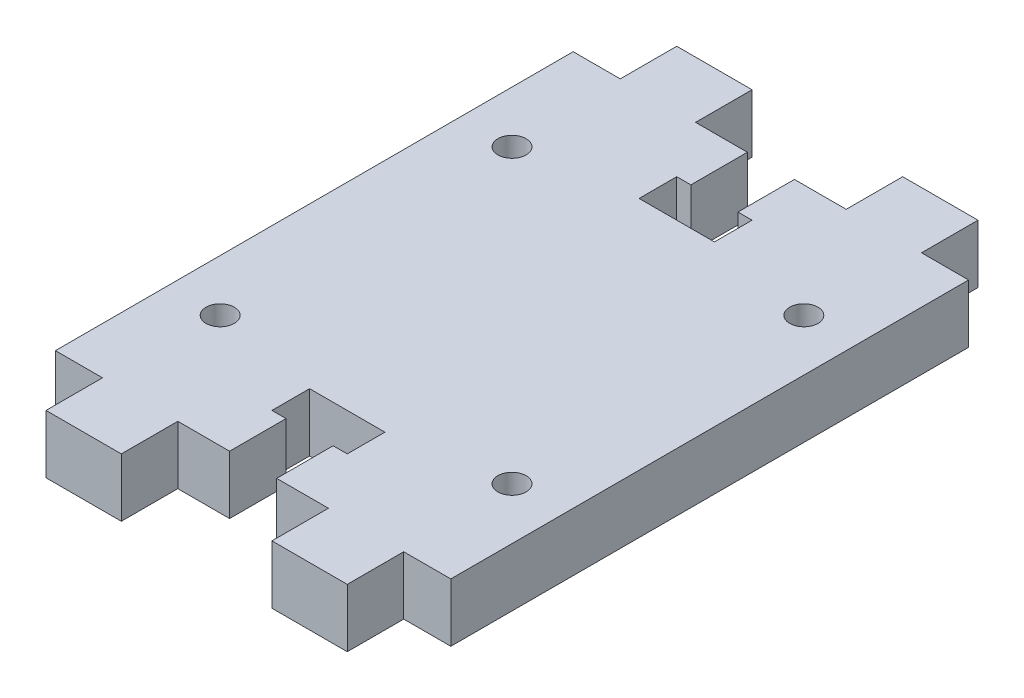
from build123d import *

# Parameters (mm, degrees)
BOSS_EXTRUDE1_DEPTH = 6.2
CUT_EXTRUDE1_REACH  = 42.021
SKETCH2_R           = 1.5


with BuildPart() as part:
    # Sketch1 → Boss-Extrude1 (new body)
    with BuildSketch(Plane(origin=(0, 0, 0), x_dir=(1, 0, 0), z_dir=(0, 1, 0))):
        Polygon((-21, 27.5), (-16, 27.5), (-16, 33.5), (-8, 33.5), (-8, 27.5), (-2.5, 27.5), (-2.5, 21.5), (-4, 21.5), (-4, 17.5), (4, 17.5), (4, 21.5), (2.5, 21.5), (2.5, 27.5), (8, 27.5), (8, 33.5), (16, 33.5), (16, 27.5), (21, 27.5), (21, -27.5), (16, -27.5), (16, -33.5), (8, -33.5), (8, -27.5), (2.5, -27.5), (2.5, -21.5), (4, -21.5), (4, -17.5), (-4, -17.5), (-4, -21.5), (-2.5, -21.5), (-2.5, -27.5), (-8, -27.5), (-8, -33.5), (-16, -33.5), (-16, -27.5), (-21, -27.5), align=None)
    extrude(amount=BOSS_EXTRUDE1_DEPTH)

    # Sketch2 → Cut-Extrude1 (cut, up to next)
    with BuildSketch(Plane(origin=(0, 6.2, 0), x_dir=(1, 0, 0), z_dir=(0, 1, 0)), mode=Mode.PRIVATE) as cut_extrude1_sk1:
        with Locations(Location((15.5, -15.5, 0), (0, 0, 270))):
            Circle(SKETCH2_R)
    cut_extrude1_tool1 = extrude(cut_extrude1_sk1.sketch, amount=-CUT_EXTRUDE1_REACH, mode=Mode.PRIVATE) & part.part
    # Sketch2 → Cut-Extrude1 (cut, up to next)
    with BuildSketch(Plane(origin=(0, 6.2, 0), x_dir=(1, 0, 0), z_dir=(0, 1, 0)), mode=Mode.PRIVATE) as cut_extrude1_sk2:
        with Locations(Location((-15.5, -15.5, 0), (0, 0, 270))):
            Circle(SKETCH2_R)
    cut_extrude1_tool2 = extrude(cut_extrude1_sk2.sketch, amount=-CUT_EXTRUDE1_REACH, mode=Mode.PRIVATE) & part.part
    # Sketch2 → Cut-Extrude1 (cut, up to next)
    with BuildSketch(Plane(origin=(0, 6.2, 0), x_dir=(1, 0, 0), z_dir=(0, 1, 0)), mode=Mode.PRIVATE) as cut_extrude1_sk3:
        with Locations(Location((-15.5, 15.5, 0), (0, 0, 270))):
            Circle(SKETCH2_R)
    cut_extrude1_tool3 = extrude(cut_extrude1_sk3.sketch, amount=-CUT_EXTRUDE1_REACH, mode=Mode.PRIVATE) & part.part
    # Sketch2 → Cut-Extrude1 (cut, up to next)
    with BuildSketch(Plane(origin=(0, 6.2, 0), x_dir=(1, 0, 0), z_dir=(0, 1, 0)), mode=Mode.PRIVATE) as cut_extrude1_sk4:
        with Locations(Location((15.5, 15.5, 0), (0, 0, 270))):
            Circle(SKETCH2_R)
    cut_extrude1_tool4 = extrude(cut_extrude1_sk4.sketch, amount=-CUT_EXTRUDE1_REACH, mode=Mode.PRIVATE) & part.part
    add(cut_extrude1_tool1.solids().sort_by_distance((15.5, 6.2, 15.5))[0], mode=Mode.SUBTRACT)
    add(cut_extrude1_tool2.solids().sort_by_distance((-15.5, 6.2, 15.5))[0], mode=Mode.SUBTRACT)
    add(cut_extrude1_tool3.solids().sort_by_distance((-15.5, 6.2, -15.5))[0], mode=Mode.SUBTRACT)
    add(cut_extrude1_tool4.solids().sort_by_distance((15.5, 6.2, -15.5))[0], mode=Mode.SUBTRACT)


solid = part.part
